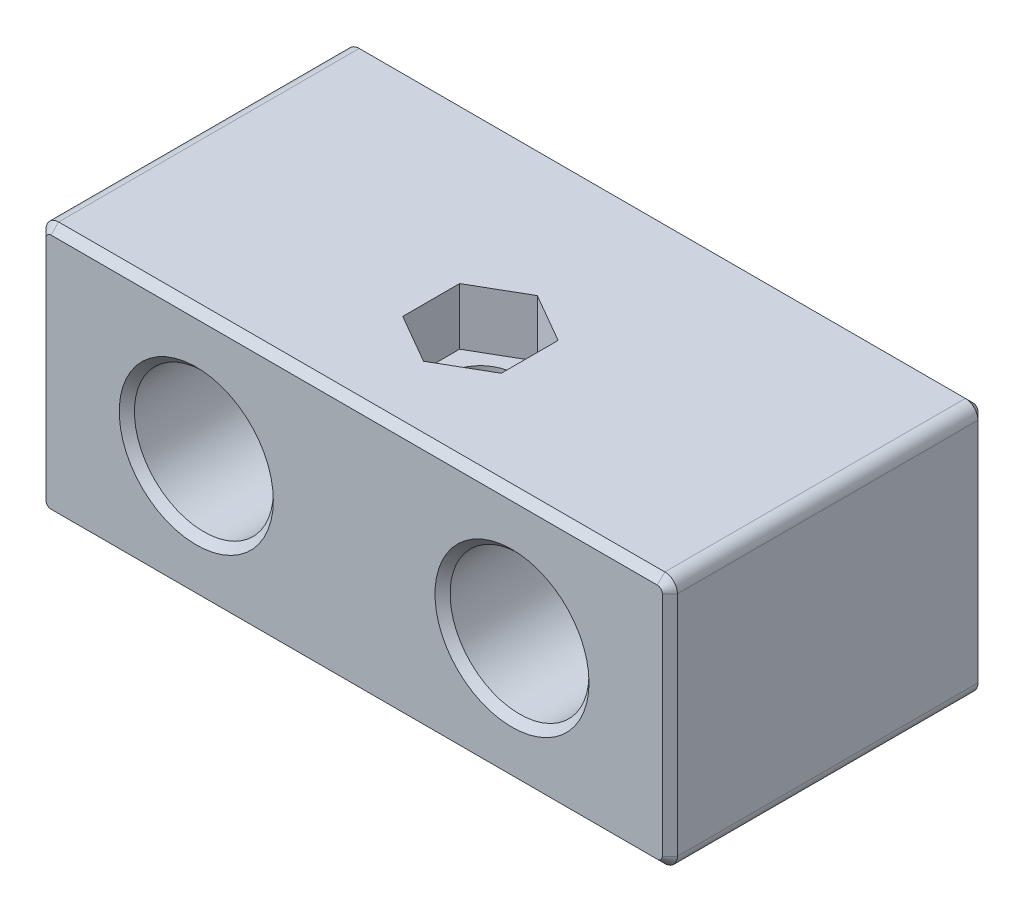
from build123d import *

# Parameters (mm, degrees)
SKETCH1_W                                           = 50
SKETCH1_H                                           = 20
BOSS_EXTRUDE1_DEPTH                                 = 25
CBORE_FOR_M6_HEX_SOCKET_HEAD_CAP_SCREW1_D           = 6.4
CBORE_FOR_M6_HEX_SOCKET_HEAD_CAP_SCREW1_CBORE_D     = 11
CBORE_FOR_M6_HEX_SOCKET_HEAD_CAP_SCREW1_CBORE_DEPTH = 12
M5_CLEARANCE_HOLE1_D                                = 5.5
CUT_EXTRUDE1_DEPTH                                  = 4.5
FILLET1_R                                           = 1
CHAMFER1_SIZE                                       = 0.6


with BuildPart() as part:
    # Sketch1 → Boss-Extrude1 (new body)
    with BuildSketch(Plane.XY):
        Rectangle(SKETCH1_W, SKETCH1_H)
    extrude(amount=BOSS_EXTRUDE1_DEPTH)

    # CBORE for M6 Hex Socket Head Cap Screw1 (through all)
    with Locations(Plane.XY.offset(25)):
        with Locations((-12.5, 0), (12.5, 0)):
            CounterBoreHole(CBORE_FOR_M6_HEX_SOCKET_HEAD_CAP_SCREW1_D / 2, CBORE_FOR_M6_HEX_SOCKET_HEAD_CAP_SCREW1_CBORE_D / 2, CBORE_FOR_M6_HEX_SOCKET_HEAD_CAP_SCREW1_CBORE_DEPTH)

    # M5 Clearance Hole1 (through all)
    with Locations(Plane(origin=(0, -10, 0), x_dir=(-1, 0, 0), z_dir=(0, -1, 0))):
        with Locations((0, -15)):
            Hole(M5_CLEARANCE_HOLE1_D / 2)

    # Sketch7 → Cut-Extrude1 (cut)
    with BuildSketch(Plane(origin=(0, 10, 0), x_dir=(1, 0, 0), z_dir=(0, 1, 0))):
        Polygon((3.9, -12.74833395), (0, -10.4966679), (-3.9, -12.74833395), (-3.9, -17.25166605), (0, -19.5033321), (3.9, -17.25166605), align=None)
    extrude(amount=-CUT_EXTRUDE1_DEPTH, mode=Mode.SUBTRACT)

    # Fillet1
    fillet1_edges = [part.edges().sort_by_distance(p)[0] for p in [
        (-25, 10, 12.5),
        (25, 10, 12.5),
        (25, -10, 12.5),
        (-25, -10, 12.5),
    ]]
    fillet(fillet1_edges, radius=FILLET1_R)

    # Chamfer1
    chamfer1_edges = [part.edges().sort_by_distance(p)[0] for p in [
        (7, 0, 25),
        (15.7, 0, 0),
        (-18, 0, 25),
        (-9.3, 0, 0),
        (-25, 0, 0),
        (-25, 0, 25),
        (0, 10, 0),
        (25, 0, 0),
        (0, -10, 0),
        (24.707106781, -9.707106781, 0),
        (24.707106781, 9.707106781, 0),
        (-24.707106781, -9.707106781, 0),
        (-24.707106781, 9.707106781, 0),
        (0, 10, 25),
        (0, -10, 25),
        (25, 0, 25),
        (24.707106781, -9.707106781, 25),
        (24.707106781, 9.707106781, 25),
        (-24.707106781, -9.707106781, 25),
        (-24.707106781, 9.707106781, 25),
    ]]
    chamfer(chamfer1_edges, length=CHAMFER1_SIZE)


solid = part.part
